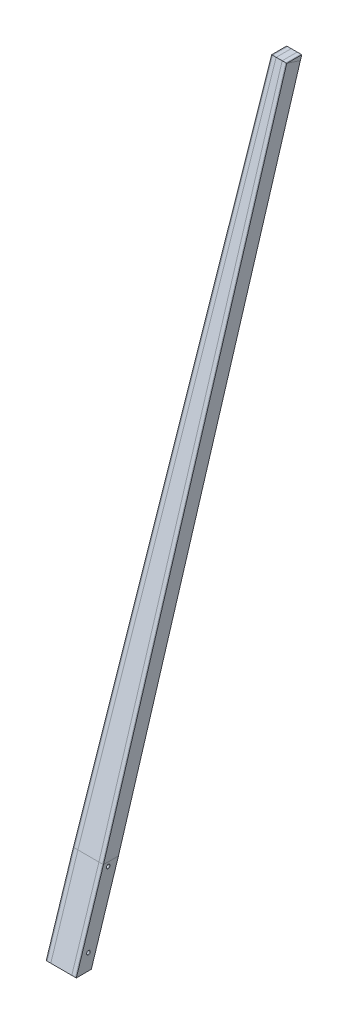
from build123d import *

# Parameters (mm, degrees)
BOSS_EXTRUDE1_DEPTH                          = 6.35
BOSS_EXTRUDE2_DEPTH                          = 12.093126424
CUT_EXTRUDE2_DEPTH                           = 530.349230516
CUT_EXTRUDE2_DEPTH_BACK                      = 530.349230516
SPLIT1_SURFACE_1_1_BACK                      = 532.923
SPLIT1_SURFACE_1_1_DEPTH                     = 1065.846
SPLIT1_SURFACE_1_2_BACK                      = 532.923
SPLIT1_SURFACE_1_2_DEPTH                     = 1065.846
SPLIT1_SURFACE_2_3_BACK                      = 532.923
SPLIT1_SURFACE_2_3_DEPTH                     = 1065.846
SPLIT1_SURFACE_2_4_BACK                      = 532.923
SPLIT1_SURFACE_2_4_DEPTH                     = 1065.846
SPLIT1_SURFACE_3_5_BACK                      = 532.923
SPLIT1_SURFACE_3_5_DEPTH                     = 1065.846
SPLIT1_SURFACE_3_6_BACK                      = 532.923
SPLIT1_SURFACE_3_6_DEPTH                     = 1065.846
SPLIT1_SURFACE_4_7_BACK                      = 532.923
SPLIT1_SURFACE_4_7_DEPTH                     = 1065.846
SPLIT1_SURFACE_4_8_BACK                      = 532.923
SPLIT1_SURFACE_4_8_DEPTH                     = 1065.846
SPAR_EXTENSION_CHANGE_LENGTH_HERE_REACH      = 533.364
SPAR_EXTENSION_CHANGE_LENGTH_HERE_DIRE_DEPTH = 75
SPLIT2_SURFACE_1_9_BACK                      = 607.831
SPLIT2_SURFACE_1_9_DEPTH                     = 1215.662
SPLIT2_SURFACE_1_10_BACK                     = 607.831
SPLIT2_SURFACE_1_10_DEPTH                    = 1215.662
SPLIT2_SURFACE_2_11_BACK                     = 607.831
SPLIT2_SURFACE_2_11_DEPTH                    = 1215.662
SPLIT2_SURFACE_2_12_BACK                     = 607.831
SPLIT2_SURFACE_2_12_DEPTH                    = 1215.662
SPLIT2_SURFACE_3_13_BACK                     = 607.831
SPLIT2_SURFACE_3_13_DEPTH                    = 1215.662
SPLIT2_SURFACE_3_14_BACK                     = 607.831
SPLIT2_SURFACE_3_14_DEPTH                    = 1215.662
SPLIT2_SURFACE_4_15_BACK                     = 607.831
SPLIT2_SURFACE_4_15_DEPTH                    = 1215.662
SPLIT2_SURFACE_4_16_BACK                     = 607.831
SPLIT2_SURFACE_4_16_DEPTH                    = 1215.662
SKETCH14_RX                                  = 1.5
SKETCH14_RY                                  = 1.49998881
CUT_EXTRUDE3_DEPTH                           = 25.4
SKETCH35_RX                                  = 1.5
SKETCH35_RY                                  = 1.49998881
CUT_EXTRUDE24_DEPTH                          = 25.4


with BuildPart() as part:
    # Sketch1 → Boss-Extrude1 (new, symmetric)
    with BuildSketch(Plane(origin=(0, 0, 0), x_dir=(0, 0, -1), z_dir=(1, 0, 0))):
        Polygon((154.702740713, 502.102), (-6.35, 0), (6.35, 0), (167.402740713, 502.102), align=None)
    extrude(amount=BOSS_EXTRUDE1_DEPTH, both=True)


with BuildPart() as body_2:
    # Sketch2 → Boss-Extrude2 (new body)
    with BuildSketch(Plane(origin=(0, 1.846799031, 5.757626248), x_dir=(1, 0, 0), z_dir=(0, 0.3054295418199495, 0.9522146790423134))):
        Polygon((-6.35, 525.359681991), (6.35, 525.359681991), (12.7, -1.939477591), (-12.7, -1.939477591), align=None)
    extrude(amount=-BOSS_EXTRUDE2_DEPTH)

    # Sketch4 → Cut-Extrude2 (cut, two sides: drawn at the far end of the back side and taken through both)
    with BuildSketch(Plane(origin=(0, 0.072673919, -0.023310669), x_dir=(0, -2.1086520054021827e-05, -0.9999999997776794), z_dir=(1, 0, 0)).offset(-CUT_EXTRUDE2_DEPTH_BACK)):
        Polygon((6.326690862, -0.072540511), (-6.373309136, -0.072808309), (5.142021243, -3.766163555), align=None)
    extrude(amount=CUT_EXTRUDE2_DEPTH + CUT_EXTRUDE2_DEPTH_BACK, mode=Mode.SUBTRACT)

    # Combine1: union part
    add(part.part)


with BuildPart() as body_2_2:
    # Split1: the piece behind the surface
    add(body_2.part)
    # Split1 surface 1: a surface, the sketch's curves swept straight by 1065.846 mm
    with BuildLine(Plane.XY.offset(-SPLIT1_SURFACE_1_1_BACK), mode=Mode.PRIVATE) as split1_surface_1_1_path:
        Line((5.689947221, 502.102), (12.039947221, 0))
    split1_surface_1_1 = Shell.extrude(split1_surface_1_1_path.wire(), (0 * SPLIT1_SURFACE_1_1_DEPTH, 0 * SPLIT1_SURFACE_1_1_DEPTH, 1 * SPLIT1_SURFACE_1_1_DEPTH))
    split(bisect_by=split1_surface_1_1, keep=Keep.BOTTOM)


with BuildPart() as body_2_1:
    add(body_2.part)

    # Split1: split by a surface, the side it looks to stays
    # Split1 surface 1: a surface, the sketch's curves swept straight by 1065.846 mm
    with BuildLine(Plane.XY.offset(-SPLIT1_SURFACE_1_2_BACK), mode=Mode.PRIVATE) as split1_surface_1_2_path:
        Line((5.689947221, 502.102), (12.039947221, 0))
    split1_surface_1_2 = Shell.extrude(split1_surface_1_2_path.wire(), (0 * SPLIT1_SURFACE_1_2_DEPTH, 0 * SPLIT1_SURFACE_1_2_DEPTH, 1 * SPLIT1_SURFACE_1_2_DEPTH))
    split(bisect_by=split1_surface_1_2, keep=Keep.TOP)


with BuildPart() as body_3:
    # Split1 2 body 2 2: the piece behind the surface
    add(body_2_2.part)
    # Split1 surface 2: a surface, the sketch's curves swept straight by 1065.846 mm
    with BuildLine(Plane.XY.offset(-SPLIT1_SURFACE_2_3_BACK), mode=Mode.PRIVATE) as split1_surface_2_3_path:
        Line((8.864693323, 0), (2.514693323, 502.102))
    split1_surface_2_3 = Shell.extrude(split1_surface_2_3_path.wire(), (0 * SPLIT1_SURFACE_2_3_DEPTH, 0 * SPLIT1_SURFACE_2_3_DEPTH, 1 * SPLIT1_SURFACE_2_3_DEPTH))
    split(bisect_by=split1_surface_2_3, keep=Keep.BOTTOM)


with BuildPart() as body_2_2_1:
    add(body_2_2.part)

    # Split1 2 body 2 2: split by a surface, the side it looks to stays
    # Split1 surface 2: a surface, the sketch's curves swept straight by 1065.846 mm
    with BuildLine(Plane.XY.offset(-SPLIT1_SURFACE_2_4_BACK), mode=Mode.PRIVATE) as split1_surface_2_4_path:
        Line((8.864693323, 0), (2.514693323, 502.102))
    split1_surface_2_4 = Shell.extrude(split1_surface_2_4_path.wire(), (0 * SPLIT1_SURFACE_2_4_DEPTH, 0 * SPLIT1_SURFACE_2_4_DEPTH, 1 * SPLIT1_SURFACE_2_4_DEPTH))
    split(bisect_by=split1_surface_2_4, keep=Keep.TOP)


with BuildPart() as body_4:
    # Split1 3 body 2 2: the piece behind the surface
    add(body_2_2_1.part)
    # Split1 surface 3: a surface, the sketch's curves swept straight by 1065.846 mm
    with BuildLine(Plane.XY.offset(-SPLIT1_SURFACE_3_5_BACK), mode=Mode.PRIVATE) as split1_surface_3_5_path:
        Line((-8.864693323, 0), (-2.514693323, 502.102))
    split1_surface_3_5 = Shell.extrude(split1_surface_3_5_path.wire(), (0 * SPLIT1_SURFACE_3_5_DEPTH, 0 * SPLIT1_SURFACE_3_5_DEPTH, 1 * SPLIT1_SURFACE_3_5_DEPTH))
    split(bisect_by=split1_surface_3_5, keep=Keep.BOTTOM)


with BuildPart() as body_2_2_2:
    add(body_2_2_1.part)

    # Split1 3 body 2 2: split by a surface, the side it looks to stays
    # Split1 surface 3: a surface, the sketch's curves swept straight by 1065.846 mm
    with BuildLine(Plane.XY.offset(-SPLIT1_SURFACE_3_6_BACK), mode=Mode.PRIVATE) as split1_surface_3_6_path:
        Line((-8.864693323, 0), (-2.514693323, 502.102))
    split1_surface_3_6 = Shell.extrude(split1_surface_3_6_path.wire(), (0 * SPLIT1_SURFACE_3_6_DEPTH, 0 * SPLIT1_SURFACE_3_6_DEPTH, 1 * SPLIT1_SURFACE_3_6_DEPTH))
    split(bisect_by=split1_surface_3_6, keep=Keep.TOP)


with BuildPart() as body_5_2:
    # Split1 4 body 2 2: the piece behind the surface
    add(body_2_2_2.part)
    # Split1 surface 4: a surface, the sketch's curves swept straight by 1065.846 mm
    with BuildLine(Plane.XY.offset(-SPLIT1_SURFACE_4_7_BACK), mode=Mode.PRIVATE) as split1_surface_4_7_path:
        Line((-5.689947221, 502.102), (-12.039947221, 0))
    split1_surface_4_7 = Shell.extrude(split1_surface_4_7_path.wire(), (0 * SPLIT1_SURFACE_4_7_DEPTH, 0 * SPLIT1_SURFACE_4_7_DEPTH, 1 * SPLIT1_SURFACE_4_7_DEPTH))
    split(bisect_by=split1_surface_4_7, keep=Keep.BOTTOM)


with BuildPart() as body_2_2_3:
    add(body_2_2_2.part)

    # Split1 4 body 2 2: split by a surface, the side it looks to stays
    # Split1 surface 4: a surface, the sketch's curves swept straight by 1065.846 mm
    with BuildLine(Plane.XY.offset(-SPLIT1_SURFACE_4_8_BACK), mode=Mode.PRIVATE) as split1_surface_4_8_path:
        Line((-5.689947221, 502.102), (-12.039947221, 0))
    split1_surface_4_8 = Shell.extrude(split1_surface_4_8_path.wire(), (0 * SPLIT1_SURFACE_4_8_DEPTH, 0 * SPLIT1_SURFACE_4_8_DEPTH, 1 * SPLIT1_SURFACE_4_8_DEPTH))
    split(bisect_by=split1_surface_4_8, keep=Keep.TOP)


with BuildPart() as body_6_2:

    # Spar Extension - change length here: up to this face of the body (flat: up to its plane)
    spar_extension_change_length_here_end = Plane(body_4.part.faces().sort_by_distance((0, 0, 0))[0])
    # Sketch12 → Spar Extension - change length here (new, up to the picked face)
    with BuildSketch(Plane(origin=(0, -1.846799031, 0.592373752), x_dir=(1, 0, 0), z_dir=(0, -0.9522146790423133, 0.30542954181994947)), mode=Mode.PRIVATE) as spar_extension_change_length_here_sk1:
        Polygon((12.653287683, -6.046563212), (-12.653287683, -6.046563212), (-12.7, 6.046563212), (12.7, 6.046563212), align=None)
    spar_extension_change_length_here_tool1 = split(extrude(spar_extension_change_length_here_sk1.sketch, amount=-SPAR_EXTENSION_CHANGE_LENGTH_HERE_REACH, mode=Mode.PRIVATE), bisect_by=spar_extension_change_length_here_end, keep=Keep.BOTH, mode=Mode.PRIVATE)
    add(spar_extension_change_length_here_tool1.solids().sort_by(Axis((0, -1.845665, 0.59591), (0, 0.9522146790423133, -0.30542954181994947)))[0])

    # Sketch12 → Spar Extension - change length here dire (add)
    with BuildSketch(Plane(origin=(0, -1.846799031, 0.592373752), x_dir=(1, 0, 0), z_dir=(0, -0.9522146790423133, 0.30542954181994947))):
        Polygon((12.653287683, -6.046563212), (-12.653287683, -6.046563212), (-12.7, 6.046563212), (12.7, 6.046563212), align=None)
    extrude(amount=SPAR_EXTENSION_CHANGE_LENGTH_HERE_DIRE_DEPTH)

    # SurfaceCut1
    split(bisect_by=Plane(origin=(0, -71.416100928, 0), x_dir=(1, 0, 0), z_dir=(0, 1, 0)), keep=Keep.TOP)


with BuildPart() as body_7:
    # Split2: the piece behind the surface
    add(body_6_2.part)
    # Split2 surface 1: a surface, the sketch's curves swept straight by 1215.662 mm
    with BuildLine(Plane(origin=(0, 1.846799031, 5.757626248), x_dir=(1, 0, 0), z_dir=(0, 0.3054295418199494, 0.9522146790423134)).offset(-SPLIT2_SURFACE_1_9_BACK), mode=Mode.PRIVATE) as split2_surface_1_9_path:
        Line((-12.039947221, -114.427383309), (-12.039947221, -76.939477591))
        Line((-12.039947221, -76.939477591), (-12.039947221, -1.939477591))
        Line((-12.039947221, -1.939477591), (-12.039947221, 35.548428127))
    split2_surface_1_9 = Shell.extrude(split2_surface_1_9_path.wire(), (0 * SPLIT2_SURFACE_1_9_DEPTH, 0.305429542 * SPLIT2_SURFACE_1_9_DEPTH, 0.952214679 * SPLIT2_SURFACE_1_9_DEPTH))
    split(bisect_by=split2_surface_1_9, keep=Keep.BOTTOM)


with BuildPart() as body_6_2_1:
    add(body_6_2.part)

    # Split2: split by a surface, the side it looks to stays
    # Split2 surface 1: a surface, the sketch's curves swept straight by 1215.662 mm
    with BuildLine(Plane(origin=(0, 1.846799031, 5.757626248), x_dir=(1, 0, 0), z_dir=(0, 0.3054295418199494, 0.9522146790423134)).offset(-SPLIT2_SURFACE_1_10_BACK), mode=Mode.PRIVATE) as split2_surface_1_10_path:
        Line((-12.039947221, -114.427383309), (-12.039947221, -76.939477591))
        Line((-12.039947221, -76.939477591), (-12.039947221, -1.939477591))
        Line((-12.039947221, -1.939477591), (-12.039947221, 35.548428127))
    split2_surface_1_10 = Shell.extrude(split2_surface_1_10_path.wire(), (0 * SPLIT2_SURFACE_1_10_DEPTH, 0.305429542 * SPLIT2_SURFACE_1_10_DEPTH, 0.952214679 * SPLIT2_SURFACE_1_10_DEPTH))
    split(bisect_by=split2_surface_1_10, keep=Keep.TOP)


with BuildPart() as body_8:
    # Split2 2 body 7: the piece behind the surface
    add(body_7.part)
    # Split2 surface 2: a surface, the sketch's curves swept straight by 1215.662 mm
    with BuildLine(Plane(origin=(0, 1.846799031, 5.757626248), x_dir=(1, 0, 0), z_dir=(0, 0.3054295418199494, 0.9522146790423134)).offset(-SPLIT2_SURFACE_2_11_BACK), mode=Mode.PRIVATE) as split2_surface_2_11_path:
        Line((-8.864693323, -114.427383309), (-8.864693323, -76.939477591))
        Line((-8.864693323, -76.939477591), (-8.864693323, -1.939477591))
        Line((-8.864693323, -1.939477591), (-8.864693323, 35.548428127))
    split2_surface_2_11 = Shell.extrude(split2_surface_2_11_path.wire(), (0 * SPLIT2_SURFACE_2_11_DEPTH, 0.305429542 * SPLIT2_SURFACE_2_11_DEPTH, 0.952214679 * SPLIT2_SURFACE_2_11_DEPTH))
    split(bisect_by=split2_surface_2_11, keep=Keep.BOTTOM)


with BuildPart() as body_7_1:
    add(body_7.part)

    # Split2 2 body 7: split by a surface, the side it looks to stays
    # Split2 surface 2: a surface, the sketch's curves swept straight by 1215.662 mm
    with BuildLine(Plane(origin=(0, 1.846799031, 5.757626248), x_dir=(1, 0, 0), z_dir=(0, 0.3054295418199494, 0.9522146790423134)).offset(-SPLIT2_SURFACE_2_12_BACK), mode=Mode.PRIVATE) as split2_surface_2_12_path:
        Line((-8.864693323, -114.427383309), (-8.864693323, -76.939477591))
        Line((-8.864693323, -76.939477591), (-8.864693323, -1.939477591))
        Line((-8.864693323, -1.939477591), (-8.864693323, 35.548428127))
    split2_surface_2_12 = Shell.extrude(split2_surface_2_12_path.wire(), (0 * SPLIT2_SURFACE_2_12_DEPTH, 0.305429542 * SPLIT2_SURFACE_2_12_DEPTH, 0.952214679 * SPLIT2_SURFACE_2_12_DEPTH))
    split(bisect_by=split2_surface_2_12, keep=Keep.TOP)


with BuildPart() as body_9:
    # Split2 3 body 8: the piece behind the surface
    add(body_8.part)
    # Split2 surface 3: a surface, the sketch's curves swept straight by 1215.662 mm
    with BuildLine(Plane(origin=(0, 1.846799031, 5.757626248), x_dir=(1, 0, 0), z_dir=(0, 0.3054295418199494, 0.9522146790423134)).offset(-SPLIT2_SURFACE_3_13_BACK), mode=Mode.PRIVATE) as split2_surface_3_13_path:
        Line((8.864693323, -114.427383309), (8.864693323, -76.939477591))
        Line((8.864693323, -76.939477591), (8.864693323, -1.939477591))
        Line((8.864693323, -1.939477591), (8.864693323, 35.548428127))
    split2_surface_3_13 = Shell.extrude(split2_surface_3_13_path.wire(), (0 * SPLIT2_SURFACE_3_13_DEPTH, 0.305429542 * SPLIT2_SURFACE_3_13_DEPTH, 0.952214679 * SPLIT2_SURFACE_3_13_DEPTH))
    split(bisect_by=split2_surface_3_13, keep=Keep.BOTTOM)


with BuildPart() as body_8_1:
    add(body_8.part)

    # Split2 3 body 8: split by a surface, the side it looks to stays
    # Split2 surface 3: a surface, the sketch's curves swept straight by 1215.662 mm
    with BuildLine(Plane(origin=(0, 1.846799031, 5.757626248), x_dir=(1, 0, 0), z_dir=(0, 0.3054295418199494, 0.9522146790423134)).offset(-SPLIT2_SURFACE_3_14_BACK), mode=Mode.PRIVATE) as split2_surface_3_14_path:
        Line((8.864693323, -114.427383309), (8.864693323, -76.939477591))
        Line((8.864693323, -76.939477591), (8.864693323, -1.939477591))
        Line((8.864693323, -1.939477591), (8.864693323, 35.548428127))
    split2_surface_3_14 = Shell.extrude(split2_surface_3_14_path.wire(), (0 * SPLIT2_SURFACE_3_14_DEPTH, 0.305429542 * SPLIT2_SURFACE_3_14_DEPTH, 0.952214679 * SPLIT2_SURFACE_3_14_DEPTH))
    split(bisect_by=split2_surface_3_14, keep=Keep.TOP)


with BuildPart() as body_10:
    # Split2 4 body 9: the piece behind the surface
    add(body_9.part)
    # Split2 surface 4: a surface, the sketch's curves swept straight by 1215.662 mm
    with BuildLine(Plane(origin=(0, 1.846799031, 5.757626248), x_dir=(1, 0, 0), z_dir=(0, 0.3054295418199494, 0.9522146790423134)).offset(-SPLIT2_SURFACE_4_15_BACK), mode=Mode.PRIVATE) as split2_surface_4_15_path:
        Line((12.039947221, -114.427383309), (12.039947221, -76.939477591))
        Line((12.039947221, -76.939477591), (12.039947221, -1.939477591))
        Line((12.039947221, -1.939477591), (12.039947221, 35.548428127))
    split2_surface_4_15 = Shell.extrude(split2_surface_4_15_path.wire(), (0 * SPLIT2_SURFACE_4_15_DEPTH, 0.305429542 * SPLIT2_SURFACE_4_15_DEPTH, 0.952214679 * SPLIT2_SURFACE_4_15_DEPTH))
    split(bisect_by=split2_surface_4_15, keep=Keep.BOTTOM)


with BuildPart() as body_9_1:
    add(body_9.part)

    # Split2 4 body 9: split by a surface, the side it looks to stays
    # Split2 surface 4: a surface, the sketch's curves swept straight by 1215.662 mm
    with BuildLine(Plane(origin=(0, 1.846799031, 5.757626248), x_dir=(1, 0, 0), z_dir=(0, 0.3054295418199494, 0.9522146790423134)).offset(-SPLIT2_SURFACE_4_16_BACK), mode=Mode.PRIVATE) as split2_surface_4_16_path:
        Line((12.039947221, -114.427383309), (12.039947221, -76.939477591))
        Line((12.039947221, -76.939477591), (12.039947221, -1.939477591))
        Line((12.039947221, -1.939477591), (12.039947221, 35.548428127))
    split2_surface_4_16 = Shell.extrude(split2_surface_4_16_path.wire(), (0 * SPLIT2_SURFACE_4_16_DEPTH, 0.305429542 * SPLIT2_SURFACE_4_16_DEPTH, 0.952214679 * SPLIT2_SURFACE_4_16_DEPTH))
    split(bisect_by=split2_surface_4_16, keep=Keep.TOP)


with BuildPart() as cut_extrude3_tool:
    # Sketch14 → Cut-Extrude3 (new body)
    with BuildSketch(Plane(origin=(12.989381009, -36.567243105, 96.755212182), x_dir=(-0.0036781051830780146, 4.339383167190218e-06, -0.9999932357388385), z_dir=(0.9999925397947919, -0.0011797788748580782, -0.0036781077428525155))):
        with Locations(Location((77.734267849, -21.458829184), (0, 0, 72.215867656))):
            Ellipse(SKETCH14_RX, SKETCH14_RY)
        with Locations(Location((94.428685486, 33.143862856), (0, 0, 72.215867656))):
            Ellipse(SKETCH14_RX, SKETCH14_RY)
    extrude(amount=-CUT_EXTRUDE3_DEPTH)


with BuildPart() as body_6_2_2:
    add(body_6_2_1.part)

    # Cut-Extrude3: cut by cut_extrude3_tool
    add(cut_extrude3_tool.part, mode=Mode.SUBTRACT)


with BuildPart() as body_7_2:
    add(body_7_1.part)

    # Cut-Extrude3: cut by cut_extrude3_tool
    add(cut_extrude3_tool.part, mode=Mode.SUBTRACT)


with BuildPart() as body_8_2:
    add(body_8_1.part)

    # Cut-Extrude3: cut by cut_extrude3_tool
    add(cut_extrude3_tool.part, mode=Mode.SUBTRACT)


with BuildPart() as body_9_2:
    add(body_9_1.part)

    # Cut-Extrude3: cut by cut_extrude3_tool
    add(cut_extrude3_tool.part, mode=Mode.SUBTRACT)


with BuildPart() as body_10_1:
    add(body_10.part)

    # Cut-Extrude3: cut by cut_extrude3_tool
    add(cut_extrude3_tool.part, mode=Mode.SUBTRACT)


with BuildPart() as cut_extrude24_tool:
    # Sketch35 → Cut-Extrude24 (new body)
    with BuildSketch(Plane(origin=(12.989381009, -36.481782529, 96.727800102), x_dir=(-0.0036781051830780146, 4.339383167190218e-06, -0.9999932357388385), z_dir=(0.9999925397947919, -0.0011797788748580723, -0.0036781077428525155))):
        with Locations(Location((77.734267849, -21.458829184), (0, 0, 72.215867656))):
            Ellipse(SKETCH35_RX, SKETCH35_RY)
        with Locations(Location((94.428685486, 33.143862856), (0, 0, 72.215867656))):
            Ellipse(SKETCH35_RX, SKETCH35_RY)
    extrude(amount=-CUT_EXTRUDE24_DEPTH)


with BuildPart() as body_6_2_3:
    add(body_6_2_2.part)

    # Cut-Extrude24: cut by cut_extrude24_tool
    add(cut_extrude24_tool.part, mode=Mode.SUBTRACT)


with BuildPart() as body_7_3:
    add(body_7_2.part)

    # Cut-Extrude24: cut by cut_extrude24_tool
    add(cut_extrude24_tool.part, mode=Mode.SUBTRACT)


with BuildPart() as body_8_3:
    add(body_8_2.part)

    # Cut-Extrude24: cut by cut_extrude24_tool
    add(cut_extrude24_tool.part, mode=Mode.SUBTRACT)


with BuildPart() as body_9_3:
    add(body_9_2.part)

    # Cut-Extrude24: cut by cut_extrude24_tool
    add(cut_extrude24_tool.part, mode=Mode.SUBTRACT)


with BuildPart() as body_10_2:
    add(body_10_1.part)

    # Cut-Extrude24: cut by cut_extrude24_tool
    add(cut_extrude24_tool.part, mode=Mode.SUBTRACT)


solid = Compound([body_2_1.part, body_3.part, body_4.part, body_5_2.part, body_2_2_3.part, body_6_2_3.part, body_7_3.part, body_8_3.part, body_9_3.part, body_10_2.part])
